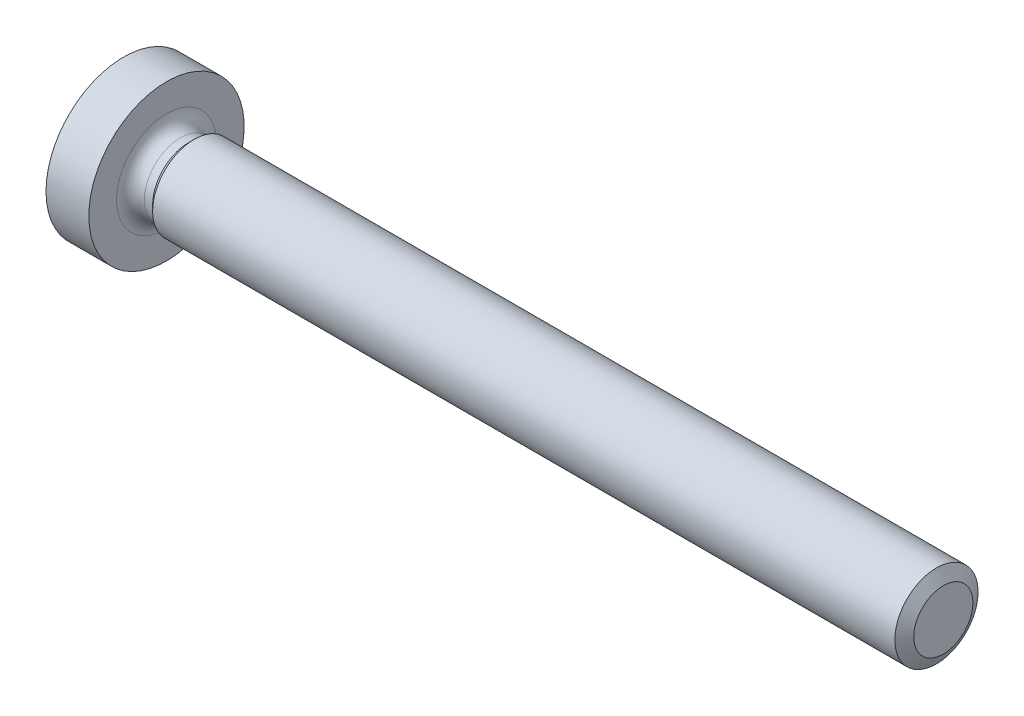
from build123d import *


with BuildPart() as part:
    # 草图2 → Revolve 816 (revolve)
    with BuildSketch(Plane.XY, mode=Mode.PRIVATE) as revolve_816_sk:
        with BuildLine():
            Line((0, 0), (30.4, 0))
            Line((30.4, 0), (30.4, 1.5))
            Line((30.4, 1.5), (3.4, 1.5))
            Line((3.4, 1.5), (3.199, 1.299))
            Line((3.199, 1.299), (2.901, 1.299))
            ThreePointArc((2.901, 1.299), (2.546739503, 1.445739503), (2.4, 1.8))
            Line((2.4, 1.8), (2.4, 2.8))
            Line((2.4, 2.8), (0.857536965, 2.8))
            ThreePointArc((0.857536965, 2.8), (0.219188606, 1.464186604), (0, 0))
        make_face()
    revolve(revolve_816_sk.sketch.rotate(Axis((-1.331757704, 0, 0), (1, 0, 0)), 90), axis=Axis((-1.331757704, 0, 0), (1, 0, 0)))

    # 草图3 → 切除-旋转1 (revolve, cut)
    with BuildSketch(Plane.XY, mode=Mode.PRIVATE) as cut_revolve_1_sk:
        Polygon((30.152708003, 1.5), (30.652708003, 1.5), (30.4, 1.067), align=None)
    revolve(cut_revolve_1_sk.sketch.rotate(Axis((-0.242766179, 0, 0), (1, 0, 0)), 90), axis=Axis((-0.242766179, 0, 0), (1, 0, 0)), mode=Mode.SUBTRACT)

    # 草图5 → 切除-放样1 section 0
    with BuildSketch(Plane(origin=(0, 0, 0), x_dir=(0, 0, -1), z_dir=(1, 0, 0)), mode=Mode.PRIVATE) as loft_1_s0:
        with BuildLine():
            Line((0.25, 1.5), (-0.25, 1.5))
            Line((-0.25, 1.5), (-0.25, -1.5))
            Line((-0.25, -1.5), (0.25, -1.5))
            Line((0.25, -1.5), (0.25, 1.5))
        make_face()
    loft_1 = loft([Vertex(1.8, 0, 0), loft_1_s0.sketch], mode=Mode.SUBTRACT)

    # 镜向1: 切除-放样1 across plane
    add(loft_1.mirror(Plane(origin=(0, 0, 0), x_dir=(0, 0.7071067811865462, 0.7071067811865488), z_dir=(0, -0.7071067811865488, 0.7071067811865462))), mode=Mode.SUBTRACT)


solid = part.part
